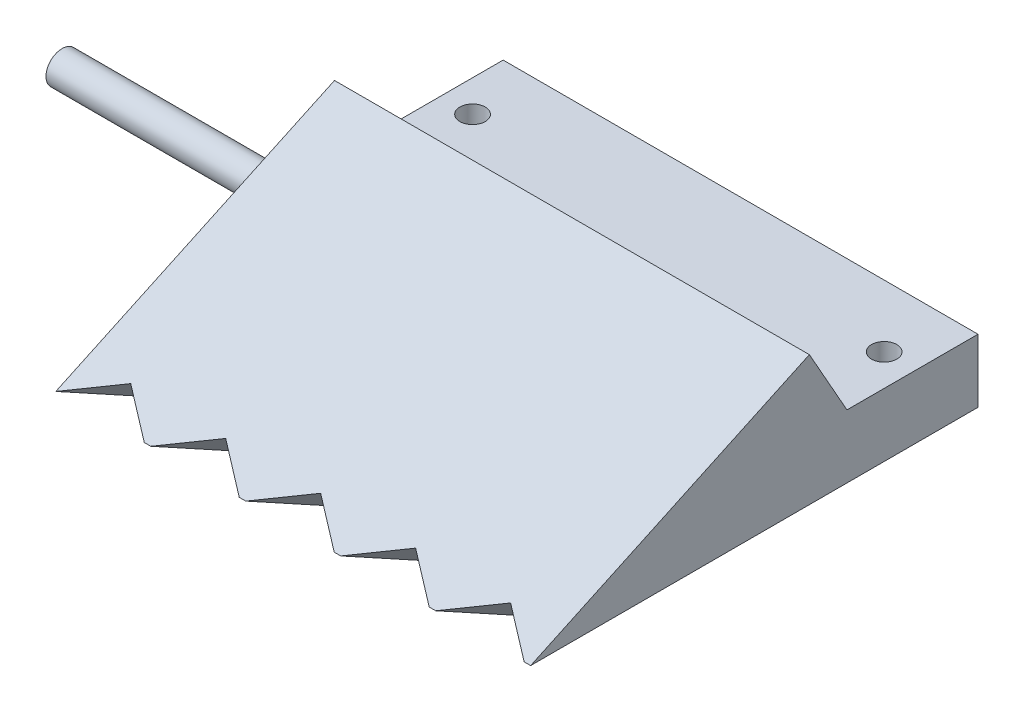
from build123d import *

# Parameters (mm, degrees)
BOSS_EXTRUDE1_DEPTH = 75
SKETCH2_R           = 2
CUT_EXTRUDE1_DEPTH  = 10
CUT_EXTRUDE2_DEPTH  = 10
CHAMFER1_SIZE       = 2
SKETCH3_R           = 2.543008444
BOSS_EXTRUDE2_DEPTH = 40


with BuildPart() as part:
    # Sketch1 → Boss-Extrude1 (new body)
    with BuildSketch(Plane(origin=(0, 0, 0), x_dir=(0, 0, -1), z_dir=(1, 0, 0))):
        Polygon((-35.447605249, 4.173188871), (35.206481481, 4.173188871), (35.206481481, 14.173188871), (14.511910864, 14.173188871), (8.571096195, 24.699446456), align=None)
    extrude(amount=BOSS_EXTRUDE1_DEPTH)

    # Sketch2 → Cut-Extrude1 (cut)
    with BuildSketch(Plane(origin=(0, 14.173188871, 0), x_dir=(1, 0, 0), z_dir=(0, 1, 0))):
        with Locations(Location((5, 25.374559272, 0), (0, 0, 270))):
            Circle(SKETCH2_R)
        with Locations(Location((69.999998955, 25.38621548, 0), (0, 0, 270))):
            Circle(SKETCH2_R)
    extrude(amount=-CUT_EXTRUDE1_DEPTH, mode=Mode.SUBTRACT)

    # Sketch4 → Cut-Extrude2 (cut)
    with BuildSketch(Plane(origin=(0, 17.005051997, 7.929585973), x_dir=(1, 0, 0), z_dir=(0, 0.9063077870366527, 0.4226182617406937))):
        Polygon((0, -30.362774842), (7.065850082, -25.103103439), (13.976560291, -30.362774842), align=None)
        Polygon((22.065850082, -25.103103439), (28.976560291, -30.362774842), (15, -30.362774842), align=None)
        Polygon((37.065850082, -25.103103439), (43.976560291, -30.362774842), (30, -30.362774842), align=None)
        Polygon((52.065850082, -25.103103439), (58.976560291, -30.362774842), (45, -30.362774842), align=None)
        Polygon((67.065850082, -25.103103439), (73.976560291, -30.362774842), (60, -30.362774842), align=None)
    extrude(amount=-CUT_EXTRUDE2_DEPTH, mode=Mode.SUBTRACT)

    # Chamfer1
    chamfer1_edges = [part.edges().sort_by_distance(p)[0] for p in [
        (5, 4.173188871, -27.374559272),
        (69.999998955, 4.173188871, -27.38621548),
    ]]
    chamfer(chamfer1_edges, length=CHAMFER1_SIZE)

    # Sketch3 → Boss-Extrude2 (add)
    with BuildSketch(Plane.ZY):
        with Locations((-5.547587106, 8.033515635)):
            Circle(SKETCH3_R)
    extrude(amount=BOSS_EXTRUDE2_DEPTH)


solid = part.part
